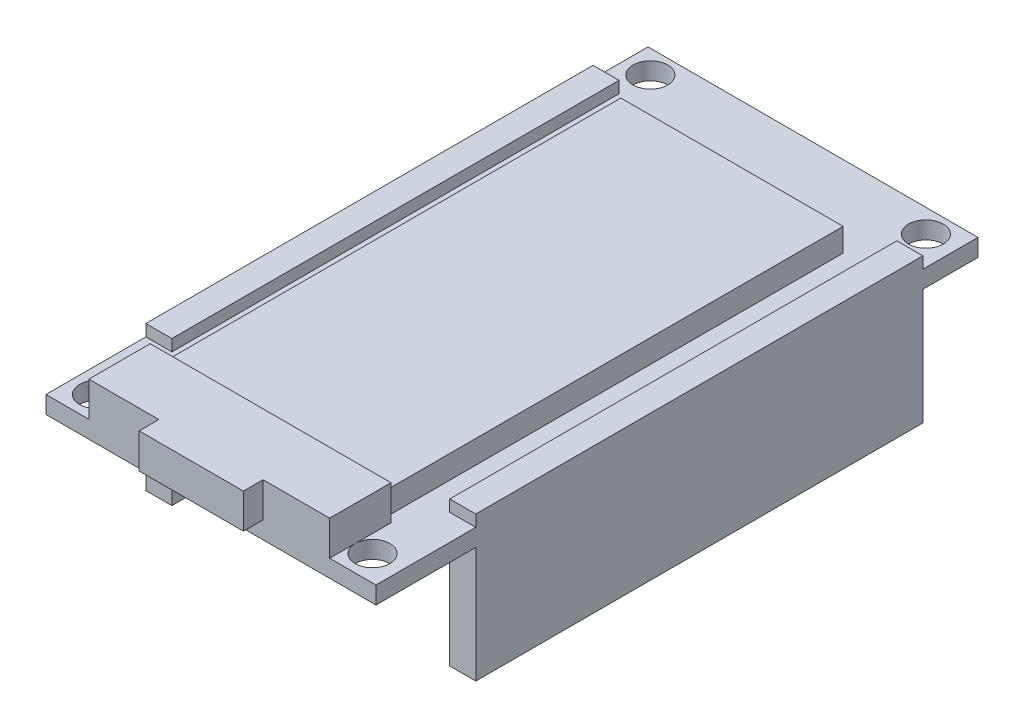
from build123d import *

# Parameters (mm, degrees)
SKETCH_2_W      = 28.5
SKETCH_2_H      = 52
SKETCH_2_R      = 1.5
EXTRUDE_1_DEPTH = 1.5
EXTRUDE_2_DEPTH = 3
SKETCH_3_W      = 5.75
SKETCH_3_H      = 5.3
SKETCH_3_W_2    = 6.05
EXTRUDE_5_DEPTH = 3
SKETCH_5_W      = 19.2
SKETCH_5_H      = 39.7
EXTRUDE_6_DEPTH = 2
SKETCH_6_W      = 2.25
SKETCH_6_H      = 38.620640838
EXTRUDE_7_DEPTH = 1
SKETCH_6_3_W    = 2.25
SKETCH_6_3_H    = 38.620640838
EXTRUDE_8_DEPTH = 11.5


with BuildPart() as part:
    # Эскиз2 → Бобышка-Вытянуть1 (new body)
    with BuildSketch(Plane(origin=(0, 0, 0), x_dir=(1, 0, 0), z_dir=(0, 1, 0))):
        with Locations((14.25, -26)):
            Rectangle(SKETCH_2_W, SKETCH_2_H)
        with Locations((2.2, -2)):
            Circle(SKETCH_2_R, mode=Mode.SUBTRACT)
        with Locations((26, -2)):
            Circle(SKETCH_2_R, mode=Mode.SUBTRACT)
        with Locations((2.2, -49.8)):
            Circle(SKETCH_2_R, mode=Mode.SUBTRACT)
        with Locations((26, -49.8)):
            Circle(SKETCH_2_R, mode=Mode.SUBTRACT)
    extrude(amount=EXTRUDE_1_DEPTH)

    # Sketch 1 → Бобышка-Вытянуть2 (add)
    with BuildSketch(Plane(origin=(9.75, 1.5, 46.7), x_dir=(0.7893522173763263, 0, 0.6139406135149205), z_dir=(0, -1, 0))):
        Polygon((0, 0), (4.297584295, 5.525465522), (11.401754251, 0), (7.104169956, -5.525465522), align=None)
    extrude(amount=-EXTRUDE_2_DEPTH)

    # Эскиз3 → Бобышка-Вытянуть5 (add)
    with BuildSketch(Plane(origin=(0, 1.5, 0), x_dir=(1, 0, 0), z_dir=(0, 1, 0))):
        with Locations((21.625, -49.35)):
            Rectangle(SKETCH_3_W, SKETCH_3_H)
        with Locations((6.725, -49.35)):
            Rectangle(SKETCH_3_W_2, SKETCH_3_H)
    extrude(amount=EXTRUDE_5_DEPTH)

    # Эскиз5 → Бобышка-Вытянуть6 (add)
    with BuildSketch(Plane(origin=(0, 1.5, 0), x_dir=(1, 0, 0), z_dir=(0, 1, 0))):
        with Locations((14.25, -26.85)):
            Rectangle(SKETCH_5_W, SKETCH_5_H)
    extrude(amount=EXTRUDE_6_DEPTH)

    # Эскиз6 → Бобышка-Вытянуть7 (add)
    with BuildSketch(Plane(origin=(0, 1.5, 0), x_dir=(1, 0, 0), z_dir=(0, 1, 0))):
        with Locations((1.125, -24.067488006)):
            Rectangle(SKETCH_6_W, SKETCH_6_H)
        with Locations((27.375, -24.067488006)):
            Rectangle(SKETCH_6_W, SKETCH_6_H)
    extrude(amount=EXTRUDE_7_DEPTH)

    # Эскиз6<3> → Бобышка-Вытянуть8 (add)
    with BuildSketch(Plane(origin=(0, 1.5, 0), x_dir=(1, 0, 0), z_dir=(0, 1, 0))):
        with Locations((1.125, -24.067488006)):
            Rectangle(SKETCH_6_3_W, SKETCH_6_3_H)
        with Locations((27.375, -24.067488006)):
            Rectangle(SKETCH_6_3_W, SKETCH_6_3_H)
    extrude(amount=-EXTRUDE_8_DEPTH)


solid = part.part
